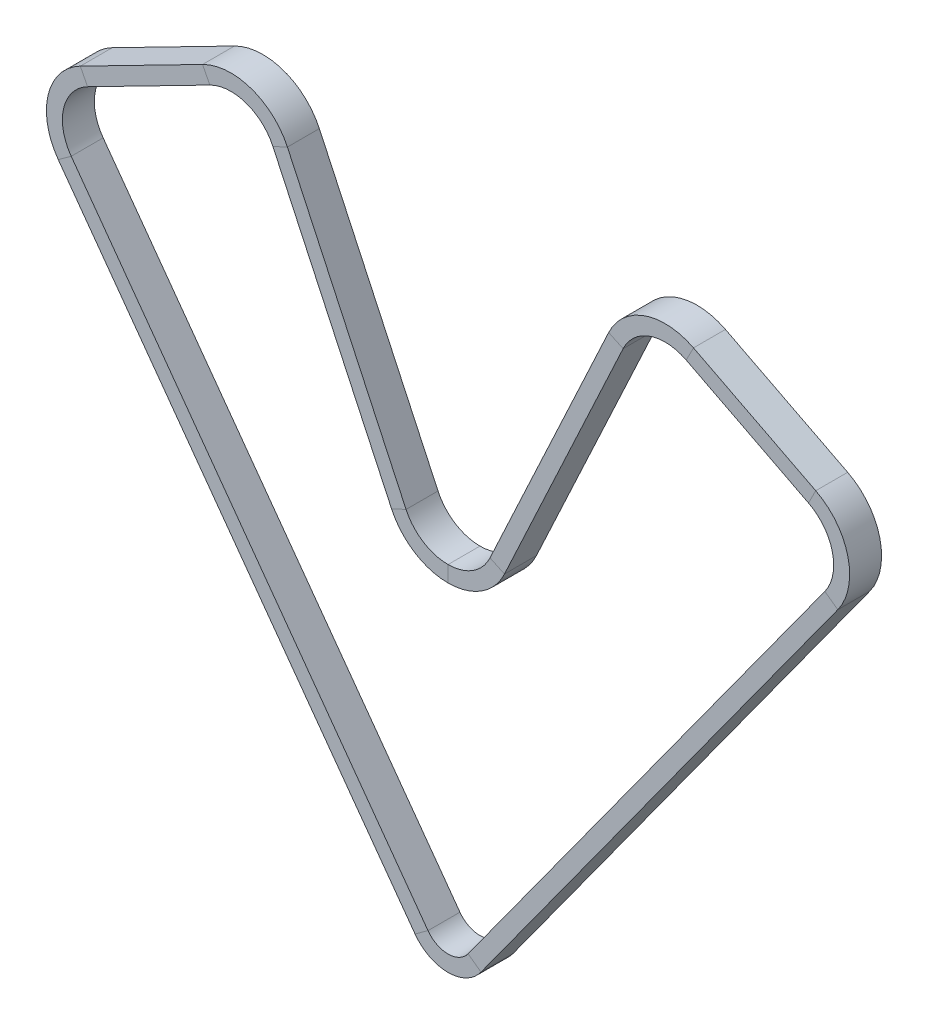
from build123d import *

# Parameters (mm, degrees)
CROQUIS3_W = 20
CROQUIS3_H = 10


with BuildPart() as part:
    # Barrer1: sweep along a path in Croquis2
    with BuildLine(Plane.XY) as barrer1_path:
        Line((-149.137435996, 156.432354984), (-225.686991426, 117.238406938))
        ThreePointArc((-225.686991426, 117.238406938), (-240.672072816, 98.182936179), (-235.950755595, 74.405367047))
        Line((-235.950755595, 74.405367047), (-12.549830507, -233.795760351))
        ThreePointArc((-12.549830507, -233.795760351), (0, -240.19896123), (12.549830507, -233.795760351))
        Line((12.549830507, -233.795760351), (235.950755595, 74.405367047))
        ThreePointArc((235.950755595, 74.405367047), (240.672072816, 98.182936179), (225.686991426, 117.238406938))
        Line((225.686991426, 117.238406938), (149.137435996, 156.432354984))
        ThreePointArc((149.137435996, 156.432354984), (126.505149479, 158.04802573), (109.636839036, 142.872687588))
        Line((109.636839036, 142.872687588), (35.347492768, -16.478918502))
        ThreePointArc((35.347492768, -16.478918502), (0, -39), (-35.347492768, -16.478918502))
        Line((-35.347492768, -16.478918502), (-109.636839036, 142.872687588))
        ThreePointArc((-109.636839036, 142.872687588), (-126.505149479, 158.04802573), (-149.137435996, 156.432354984))
    # Croquis3 → Barrer1 (sweep)
    with BuildSketch(Plane(origin=(0, 0, 0), x_dir=(0, 0, -1), z_dir=(1, 0, 0))):
        with Locations((0, -34)):
            Rectangle(CROQUIS3_W, CROQUIS3_H)
    sweep(path=barrer1_path.line)


solid = part.part
